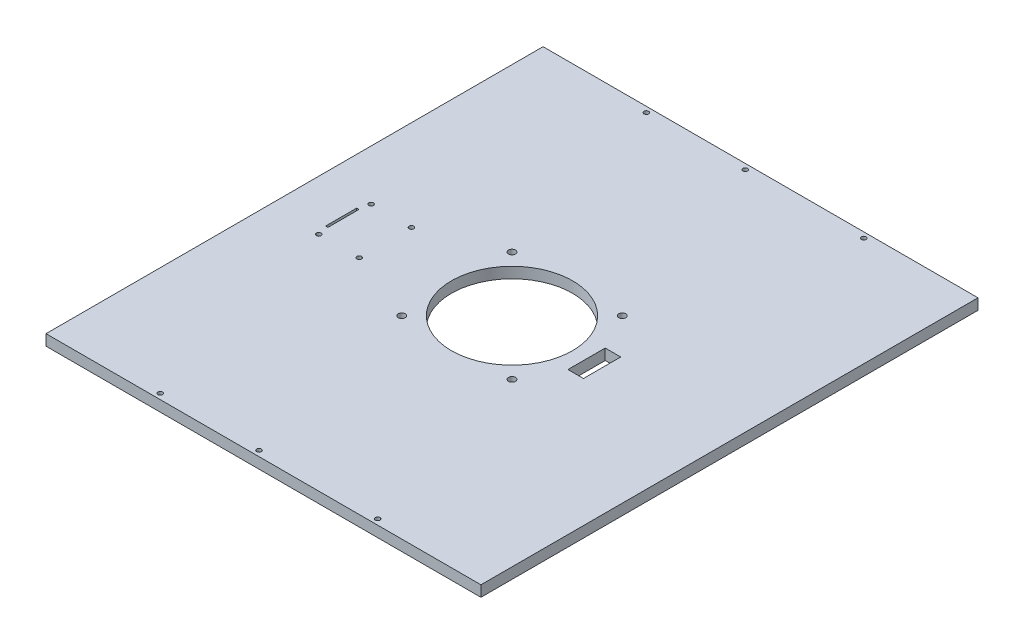
from build123d import *

# Parameters (mm, degrees)
SKETCH1_W           = 280
SKETCH1_H           = 320
SKETCH1_R           = 1.5
BOSS_EXTRUDE1_DEPTH = 7
SKETCH2_R           = 39
SKETCH2_R_2         = 2.25
SKETCH2_R_3         = 1.5
SKETCH2_W           = 10
SKETCH2_H           = 24
SKETCH2_W_2         = 1.5
SKETCH2_H_2         = 20
CUT_EXTRUDE1_DEPTH  = 10


with BuildPart() as part:
    # Sketch1 → Boss-Extrude1 (new body)
    with BuildSketch(Plane(origin=(0, 0, 0), x_dir=(1, 0, 0), z_dir=(0, 1, 0))):
        Rectangle(SKETCH1_W, SKETCH1_H)
        with Locations(Location((-6.376642336, -156.5, 0), (0, 0, 270))):
            Circle(SKETCH1_R, mode=Mode.SUBTRACT)
        with Locations(Location((-70, 156.5, 0), (0, 0, 270))):
            Circle(SKETCH1_R, mode=Mode.SUBTRACT)
        with Locations(Location((-6.376642336, 156.5, 0), (0, 0, 270))):
            Circle(SKETCH1_R, mode=Mode.SUBTRACT)
        with Locations(Location((70, 156.5, 0), (0, 0, 270))):
            Circle(SKETCH1_R, mode=Mode.SUBTRACT)
        with Locations(Location((70, -156.5, 0), (0, 0, 270))):
            Circle(SKETCH1_R, mode=Mode.SUBTRACT)
        with Locations(Location((-70, -156.5, 0), (0, 0, 270))):
            Circle(SKETCH1_R, mode=Mode.SUBTRACT)
    extrude(amount=BOSS_EXTRUDE1_DEPTH)

    # Sketch2 → Cut-Extrude1 (cut)
    with BuildSketch(Plane(origin=(0, 7, 0), x_dir=(1, 0, 0), z_dir=(0, 1, 0))):
        with Locations(Location((0, 0, 0), (0, 0, 270))):
            Circle(SKETCH2_R)
        with Locations(Location((-35.5, 35.5, 0), (0, 0, 270))):
            Circle(SKETCH2_R_2)
        with Locations(Location((35.5, 35.5, 0), (0, 0, 270))):
            Circle(SKETCH2_R_2)
        with Locations(Location((35.5, -35.5, 0), (0, 0, 270))):
            Circle(SKETCH2_R_2)
        with Locations(Location((-35.5, -35.5, 0), (0, 0, 270))):
            Circle(SKETCH2_R_2)
        with Locations(Location((-107.555652062, 16.833746195, 0), (0, 0, 270))):
            Circle(SKETCH2_R_3)
        with Locations(Location((-81.564347938, 16.833746195, 0), (0, 0, 270))):
            Circle(SKETCH2_R_3)
        with Locations(Location((-107.555652062, -16.833746195, 0), (0, 0, 270))):
            Circle(SKETCH2_R_3)
        with Locations(Location((-81.564347938, -16.833746195, 0), (0, 0, 270))):
            Circle(SKETCH2_R_3)
        with Locations((53, 0)):
            Rectangle(SKETCH2_W, SKETCH2_H)
        with Locations((-109.25, 0)):
            Rectangle(SKETCH2_W_2, SKETCH2_H_2)
    extrude(amount=-CUT_EXTRUDE1_DEPTH, mode=Mode.SUBTRACT)


solid = part.part
